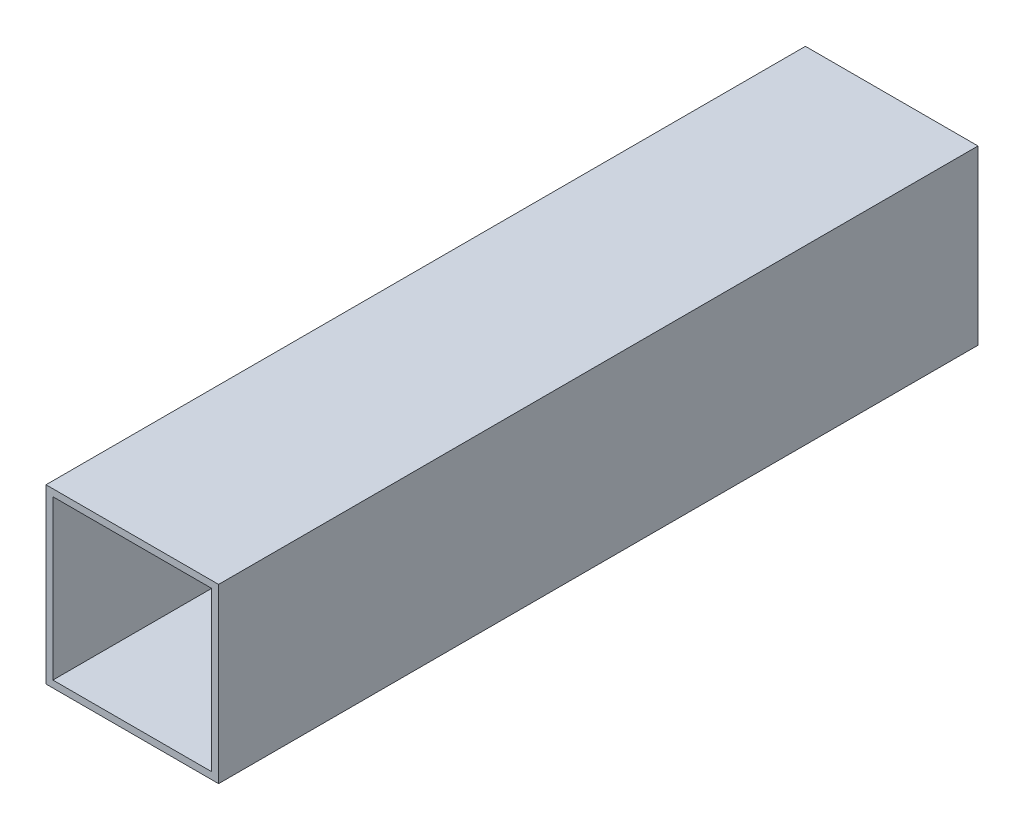
from build123d import *

# Parameters (mm, degrees)
SKETCH1_W           = 50
SKETCH1_H           = 50
SKETCH1_W_2         = 46
SKETCH1_H_2         = 46
BOSS_EXTRUDE1_DEPTH = 220


with BuildPart() as part:
    # Sketch1 → Boss-Extrude1 (new body)
    with BuildSketch(Plane.XY):
        Rectangle(SKETCH1_W, SKETCH1_H)
        Rectangle(SKETCH1_W_2, SKETCH1_H_2, mode=Mode.SUBTRACT)
    extrude(amount=BOSS_EXTRUDE1_DEPTH)


solid = part.part
